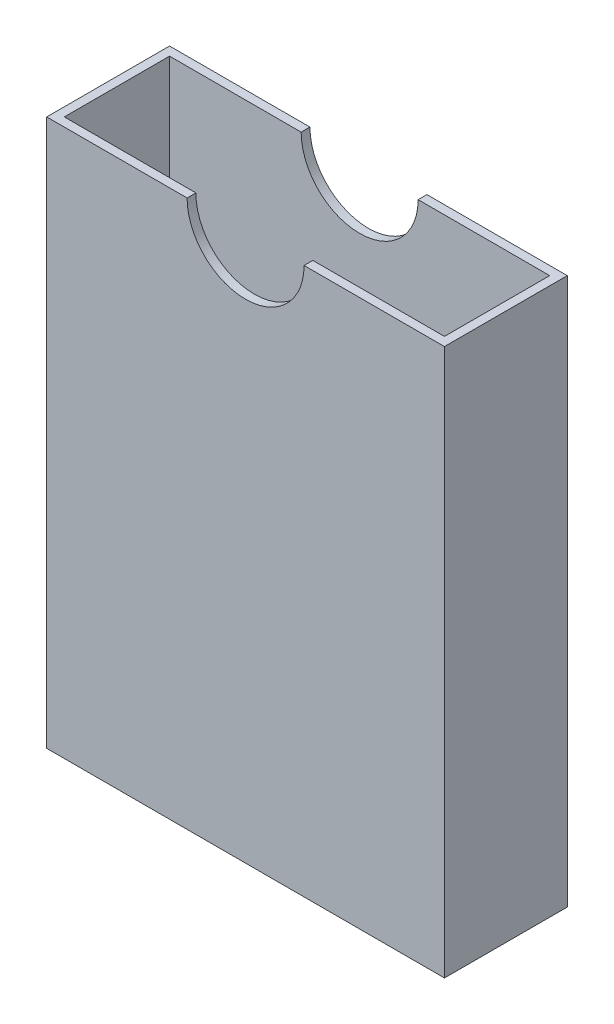
from build123d import *

# Parameters (mm, degrees)
SKETCH1_W           = 68
SKETCH1_H           = 21
SKETCH1_W_2         = 65
SKETCH1_H_2         = 18
BOSS_EXTRUDE1_DEPTH = 1.5
SKETCH2_W           = 68
SKETCH2_H           = 21
SKETCH2_W_2         = 65
SKETCH2_H_2         = 18
BOSS_EXTRUDE2_DEPTH = 92
CUT_EXTRUDE1_REACH  = 103.682


with BuildPart() as part:
    # Sketch1 → Boss-Extrude1 (new body)
    # profile 1 of 2: a face of its own
    with BuildSketch(Plane(origin=(0, 0, 0), x_dir=(1, 0, 0), z_dir=(0, 1, 0))):
        Rectangle(SKETCH1_W, SKETCH1_H)
        Rectangle(SKETCH1_W_2, SKETCH1_H_2, mode=Mode.SUBTRACT)
    # profile 2 of 2: a face of its own
    with BuildSketch(Plane(origin=(0, 0, 0), x_dir=(1, 0, 0), z_dir=(0, 1, 0))):
        Rectangle(SKETCH1_W_2, SKETCH1_H_2)
    extrude(amount=BOSS_EXTRUDE1_DEPTH)

    # Sketch2 → Boss-Extrude2 (add)
    with BuildSketch(Plane(origin=(0, 1.5, 0), x_dir=(1, 0, 0), z_dir=(0, 1, 0))):
        Rectangle(SKETCH2_W, SKETCH2_H)
        Rectangle(SKETCH2_W_2, SKETCH2_H_2, mode=Mode.SUBTRACT)
    extrude(amount=BOSS_EXTRUDE2_DEPTH)

    # Cut-Extrude1: up to this face of the body (flat: up to its plane)
    cut_extrude1_end = Plane(part.part.faces().sort_by_distance((0, 46.75, -10.5))[0])
    # Sketch3 → Cut-Extrude1 (cut, up to the picked face)
    with BuildSketch(Plane.XY.offset(10.5), mode=Mode.PRIVATE) as cut_extrude1_sk1:
        with BuildLine():
            Line((10, 93.5), (0, 93.5))
            Line((0, 93.5), (0, 83.5))
            ThreePointArc((0, 83.5), (7.071067812, 86.428932188), (10, 93.5))
        make_face()
    cut_extrude1_tool1 = split(extrude(cut_extrude1_sk1.sketch, amount=-CUT_EXTRUDE1_REACH, mode=Mode.PRIVATE), bisect_by=cut_extrude1_end, keep=Keep.BOTH, mode=Mode.PRIVATE)
    # Sketch3 → Cut-Extrude1 (cut, up to the picked face)
    with BuildSketch(Plane.XY.offset(10.5), mode=Mode.PRIVATE) as cut_extrude1_sk2:
        with BuildLine():
            Line((0, 83.5), (0, 93.5))
            Line((0, 93.5), (-10, 93.5))
            ThreePointArc((-10, 93.5), (-7.071067812, 86.428932188), (0, 83.5))
        make_face()
    cut_extrude1_tool2 = split(extrude(cut_extrude1_sk2.sketch, amount=-CUT_EXTRUDE1_REACH, mode=Mode.PRIVATE), bisect_by=cut_extrude1_end, keep=Keep.BOTH, mode=Mode.PRIVATE)
    # Sketch3 → Cut-Extrude1 (cut, up to the picked face)
    with BuildSketch(Plane.XY.offset(10.5), mode=Mode.PRIVATE) as cut_extrude1_sk3:
        with BuildLine():
            Line((10, 93.5), (0, 93.5))
            Line((0, 93.5), (0, 83.5))
            ThreePointArc((0, 83.5), (7.071067812, 86.428932188), (10, 93.5))
        make_face()
    cut_extrude1_tool3 = split(extrude(cut_extrude1_sk3.sketch, amount=-CUT_EXTRUDE1_REACH, mode=Mode.PRIVATE), bisect_by=cut_extrude1_end, keep=Keep.BOTH, mode=Mode.PRIVATE)
    # Sketch3 → Cut-Extrude1 (cut, up to the picked face)
    with BuildSketch(Plane.XY.offset(10.5), mode=Mode.PRIVATE) as cut_extrude1_sk4:
        with BuildLine():
            Line((0, 83.5), (0, 93.5))
            Line((0, 93.5), (-10, 93.5))
            ThreePointArc((-10, 93.5), (-7.071067812, 86.428932188), (0, 83.5))
        make_face()
    cut_extrude1_tool4 = split(extrude(cut_extrude1_sk4.sketch, amount=-CUT_EXTRUDE1_REACH, mode=Mode.PRIVATE), bisect_by=cut_extrude1_end, keep=Keep.BOTH, mode=Mode.PRIVATE)
    add(cut_extrude1_tool1.solids().sort_by(Axis((4.244132, 89.255868, 10.5), (0, 0, -1)))[0], mode=Mode.SUBTRACT)
    add(cut_extrude1_tool2.solids().sort_by(Axis((-4.244132, 89.255868, 10.5), (0, 0, -1)))[0], mode=Mode.SUBTRACT)
    add(cut_extrude1_tool3.solids().sort_by(Axis((4.244132, 89.255868, 10.5), (0, 0, -1)))[0], mode=Mode.SUBTRACT)
    add(cut_extrude1_tool4.solids().sort_by(Axis((-4.244132, 89.255868, 10.5), (0, 0, -1)))[0], mode=Mode.SUBTRACT)


solid = part.part
